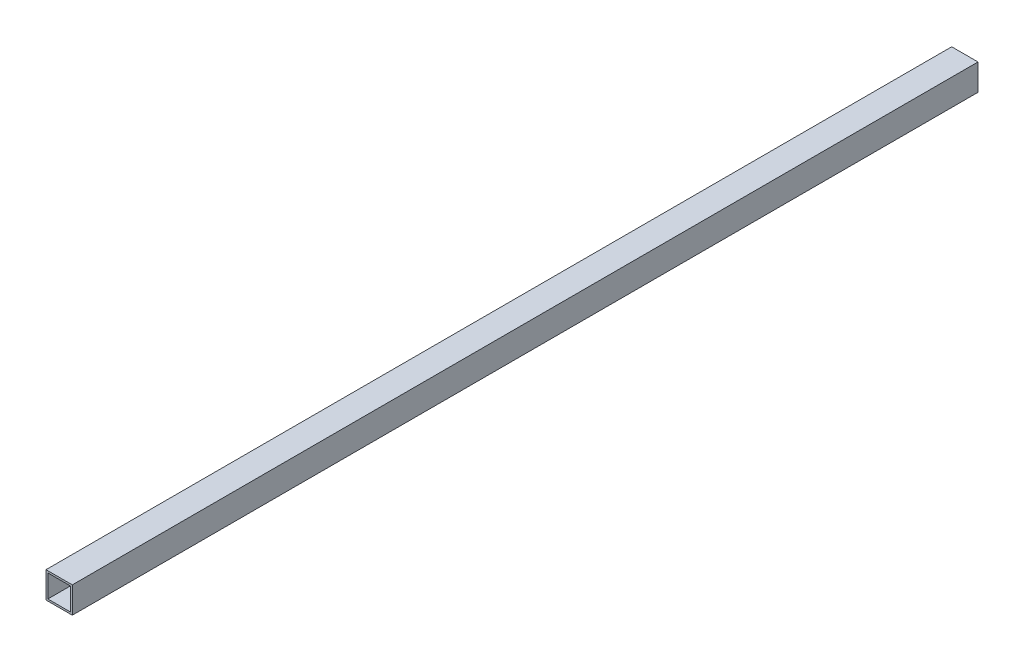
from build123d import *

# Parameters (mm, degrees)
SKETCH2_W           = 44.45
SKETCH2_H           = 44.45
SKETCH2_W_2         = 38.1
SKETCH2_H_2         = 38.1
BOSS_EXTRUDE1_DEPTH = 1530.35


with BuildPart() as part:
    # Sketch2 → Boss-Extrude1 (new body)
    with BuildSketch(Plane.XY):
        Rectangle(SKETCH2_W, SKETCH2_H)
        Rectangle(SKETCH2_W_2, SKETCH2_H_2, mode=Mode.SUBTRACT)
    extrude(amount=-BOSS_EXTRUDE1_DEPTH)


solid = part.part
